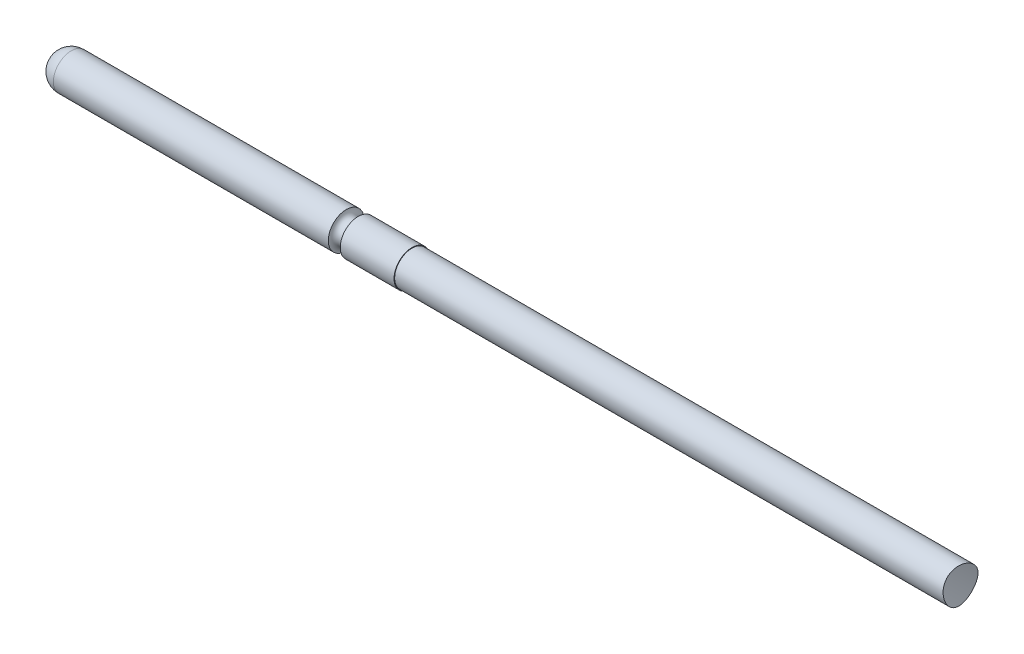
from build123d import *

# Parameters (mm, degrees)
BOSS_EXTRUDE1_REACH      = 46.947
BOSS_EXTRUDE1_END_RADIUS = 6.2
SKETCH2_R                = 1.45


with BuildPart() as part:
    # Sketch1 → Revolve1 (revolve)
    with BuildSketch(Plane(origin=(0, 0, 0), x_dir=(-1, 0, 0), z_dir=(0, 0, -1)), mode=Mode.PRIVATE) as revolve1_sk:
        with BuildLine():
            Line((-30, 1.5), (-30, 0))
            Line((-30, 0), (0, 0))
            ThreePointArc((0, 0), (-0.439339828, 1.060660172), (-1.5, 1.5))
            Line((-1.5, 1.5), (-24.5, 1.5))
            ThreePointArc((-24.5, 1.5), (-25, 1), (-25.5, 1.5))
            Line((-25.5, 1.5), (-30, 1.5))
        make_face()
    revolve(revolve1_sk.sketch.rotate(Axis((30, 0, 0), (-1, 0, 0)), 270), axis=Axis((30, 0, 0), (-1, 0, 0)))

    # Boss-Extrude1: up to this cylinder (the profile starts outside it)
    boss_extrude1_end = Plane(origin=(82, 0, 0), z_dir=(0, 0.7071067811865475, 0.7071067811865476)) * Cylinder(BOSS_EXTRUDE1_END_RADIUS, 107.294, mode=Mode.PRIVATE)
    # Sketch2 → Boss-Extrude1 (add, up to the surface)
    with BuildSketch(Plane(origin=(30, 0, 0), x_dir=(0, 0, -1), z_dir=(1, 0, 0)), mode=Mode.PRIVATE) as boss_extrude1_sk1:
        with Locations(Location((0, 0, 0), (0, 0, 180.053796912))):
            Circle(SKETCH2_R)
    boss_extrude1_tool1 = extrude(boss_extrude1_sk1.sketch, amount=BOSS_EXTRUDE1_REACH, mode=Mode.PRIVATE) - boss_extrude1_end
    add(boss_extrude1_tool1.solids().sort_by_distance((30, 0, 0))[0])


solid = part.part
